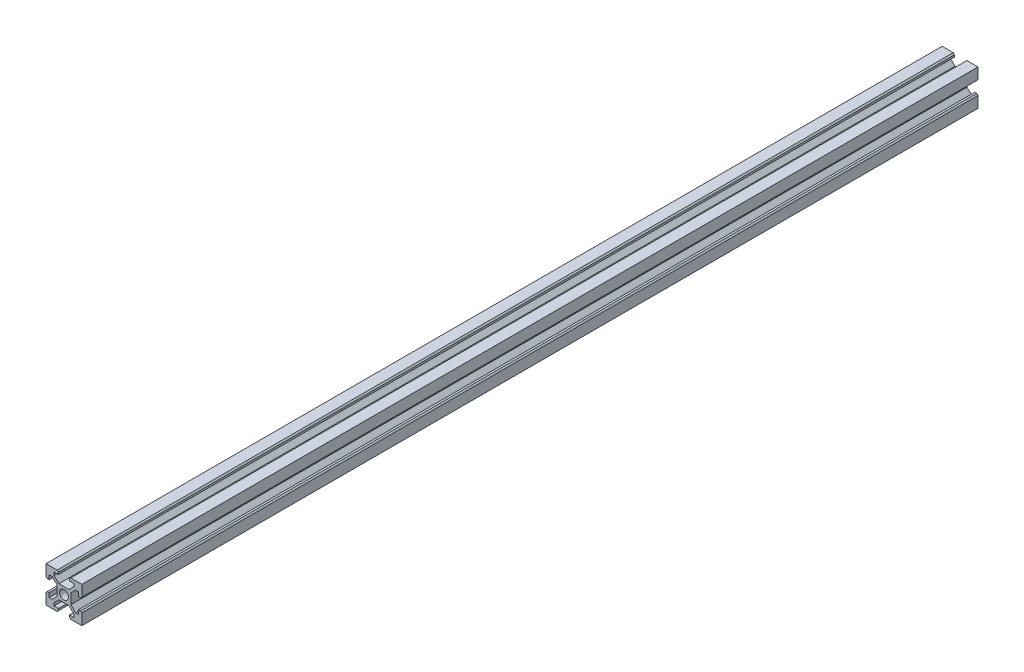
from build123d import *

# Parameters (mm, degrees)
SKETCH1_R           = 2.5
BOSS_EXTRUDE1_DEPTH = 250


with BuildPart() as part:
    # Sketch1 → Boss-Extrude1 (new, symmetric)
    with BuildSketch(Plane.XY):
        Polygon((3.9, -2.839339828), (6.560660172, -5.5), (8.200660172, -5.5), (8.200660172, -3.1), (9.3, -3.1), (10, -3.8), (10, -10), (3.8, -10), (3.1, -9.3), (3.1, -8.200660172), (5.5, -8.200660172), (5.5, -6.560660172), (2.839339828, -3.9), (-2.839339828, -3.9), (-5.5, -6.560660172), (-5.5, -8.200660172), (-3.1, -8.200660172), (-3.1, -9.3), (-3.8, -10), (-10, -10), (-10, -3.8), (-9.3, -3.1), (-8.200660172, -3.1), (-8.200660172, -5.5), (-6.560660172, -5.5), (-3.9, -2.839339828), (-3.9, 2.839339828), (-6.560660172, 5.5), (-8.200660172, 5.5), (-8.200660172, 3.1), (-9.3, 3.1), (-10, 3.8), (-10, 10), (-3.8, 10), (-3.1, 9.3), (-3.1, 8.200660172), (-5.5, 8.200660172), (-5.5, 6.560660172), (-2.839339828, 3.9), (2.839339828, 3.9), (5.5, 6.560660172), (5.5, 8.200660172), (3.1, 8.200660172), (3.1, 9.3), (3.8, 10), (10, 10), (10, 3.8), (9.3, 3.1), (8.200660172, 3.1), (8.200660172, 5.5), (6.560660172, 5.5), (3.9, 2.839339828), align=None)
        Circle(SKETCH1_R, mode=Mode.SUBTRACT)
    extrude(amount=BOSS_EXTRUDE1_DEPTH, both=True)


solid = part.part
